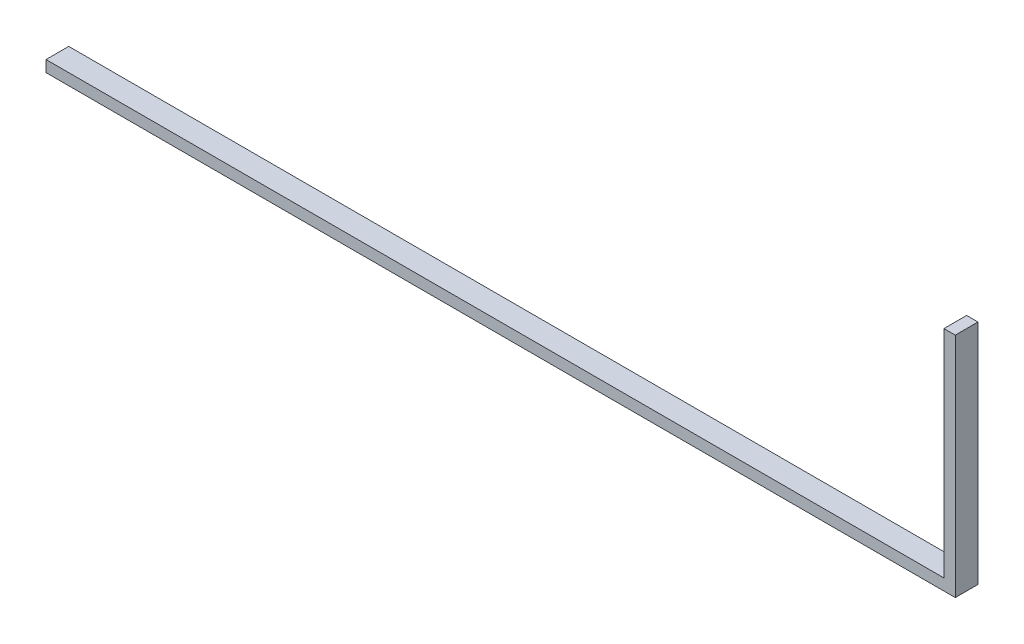
from build123d import *

# Parameters (mm, degrees)
EXTRUDE_1_DEPTH = 100


with BuildPart() as part:
    # 草图1 → 凸台-拉伸1 (new body)
    with BuildSketch(Plane.XY):
        Polygon((0, 0), (4000, 0), (4000, 1000), (3950, 1000), (3950, 50), (0, 50), align=None)
    extrude(amount=EXTRUDE_1_DEPTH)


solid = part.part
